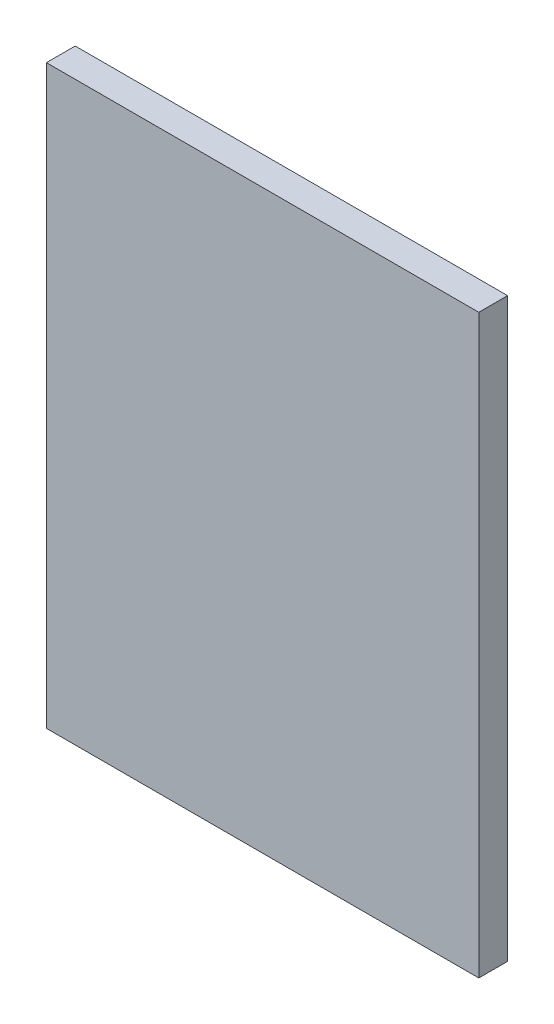
from build123d import *

# Parameters (mm, degrees)
SKETCH1_W           = 15
SKETCH1_H           = 20
BOSS_EXTRUDE1_DEPTH = 1
SKETCH2_W           = 9.75
SKETCH2_H           = 12
BOSS_EXTRUDE2_DEPTH = 2


with BuildPart() as part:
    # Sketch1 → Boss-Extrude1 (new body)
    with BuildSketch(Plane.XY):
        Rectangle(SKETCH1_W, SKETCH1_H)
    extrude(amount=-BOSS_EXTRUDE1_DEPTH)

    # Sketch2 → Boss-Extrude2 (add)
    with BuildSketch(Plane.XY):
        Rectangle(SKETCH2_W, SKETCH2_H)
    extrude(amount=-BOSS_EXTRUDE2_DEPTH)


solid = part.part
